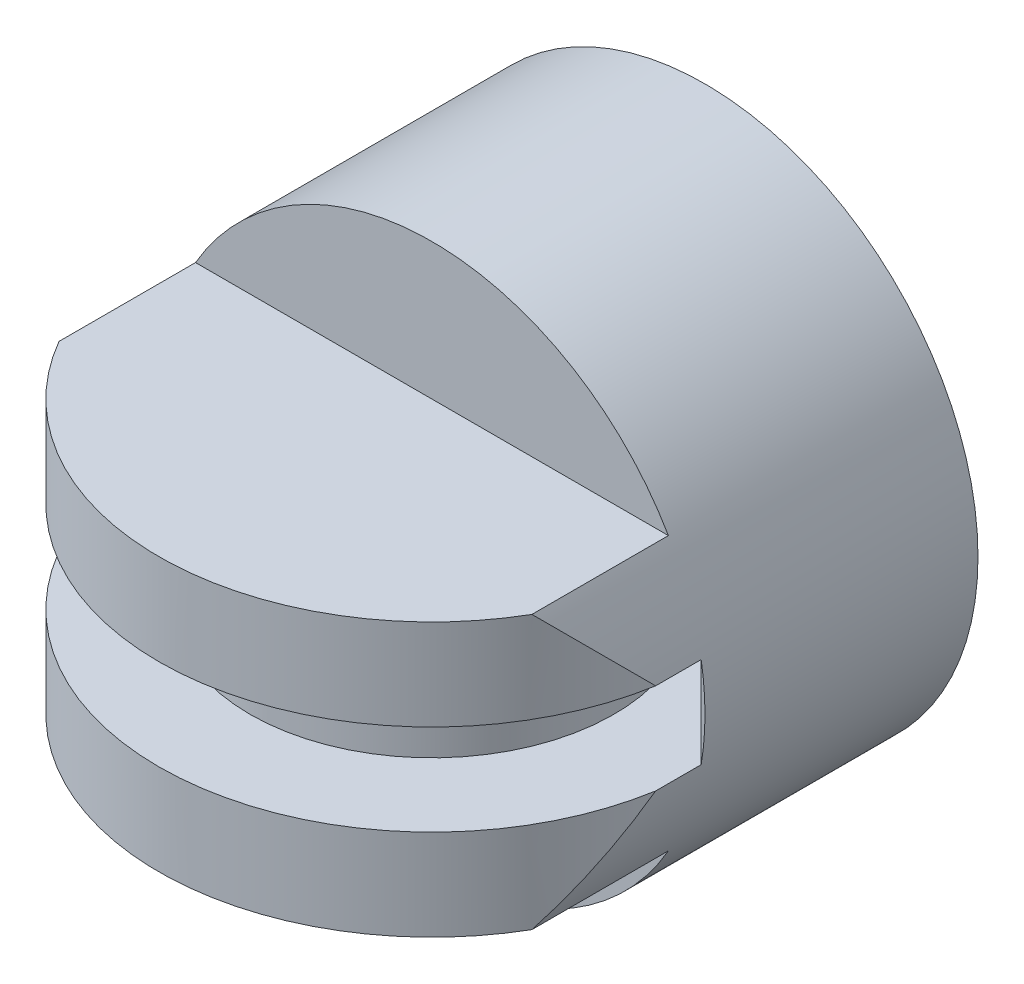
from build123d import *

# Parameters (mm, degrees)
SKETCH1_R               = 20
BOSS_EXTRUDE1_DEPTH     = 10
SKETCH2_R               = 30
BOSS_EXTRUDE2_DEPTH     = 10
BOSS_EXTRUDE3_START     = 10
SKETCH3_R               = 30
BOSS_EXTRUDE3_DEPTH     = 10
SKETCH9_R               = 30
BOSS_EXTRUDE7_DEPTH     = 30
CUT_EXTRUDE1_DEPTH      = 56
CUT_EXTRUDE1_DEPTH_BACK = 56
SKETCH13_R              = 36.178766014
SKETCH13_R_2            = 30
SKETCH14_W              = 9.580398915
SKETCH14_H              = 10
CUT_REVOLVE6_ANGLE      = 180


with BuildPart() as part:
    # Sketch1 → Boss-Extrude1 (new body)
    with BuildSketch(Plane(origin=(0, 0, 0), x_dir=(1, 0, 0), z_dir=(0, 1, 0))):
        with Locations(Location((0, 0, 0), (0, 0, 270))):
            Circle(SKETCH1_R)
    extrude(amount=BOSS_EXTRUDE1_DEPTH)

    # Sketch2 → Boss-Extrude2 (add)
    with BuildSketch(Plane(origin=(0, 10, 0), x_dir=(1, 0, 0), z_dir=(0, 1, 0))):
        with Locations(Location((0, 0, 0), (0, 0, 270))):
            Circle(SKETCH2_R)
    extrude(amount=BOSS_EXTRUDE2_DEPTH)

    # Sketch3 → Boss-Extrude3 (add)
    with BuildSketch(Plane.XZ.offset(BOSS_EXTRUDE3_START)):
        with Locations(Location((0, 0, 0), (0, 0, 90))):
            Circle(SKETCH3_R)
    extrude(amount=-BOSS_EXTRUDE3_DEPTH)

    # Sketch9 → Boss-Extrude7 (add)
    with BuildSketch(Plane.XY):
        with Locations((0, 5)):
            Circle(SKETCH9_R)
    extrude(amount=-BOSS_EXTRUDE7_DEPTH)

    # Sketch13 → Cut-Extrude1 (cut, two sides: drawn at the far end of the back side and taken through both)
    with BuildSketch(Plane.XY.offset(-CUT_EXTRUDE1_DEPTH_BACK)):
        with Locations((0, 5)):
            Circle(SKETCH13_R)
        with Locations((0, 5)):
            Circle(SKETCH13_R_2, mode=Mode.SUBTRACT)
    extrude(amount=CUT_EXTRUDE1_DEPTH + CUT_EXTRUDE1_DEPTH_BACK, mode=Mode.SUBTRACT)

    # Sketch14 → Cut-Revolve6 (revolve, cut)
    with BuildSketch(Plane.XY):
        with Locations((24.790199458, 5)):
            Rectangle(SKETCH14_W, SKETCH14_H)
    revolve(axis=Axis((0, 0, 0), (0, 1, 0)), revolution_arc=CUT_REVOLVE6_ANGLE, mode=Mode.SUBTRACT)


solid = part.part
